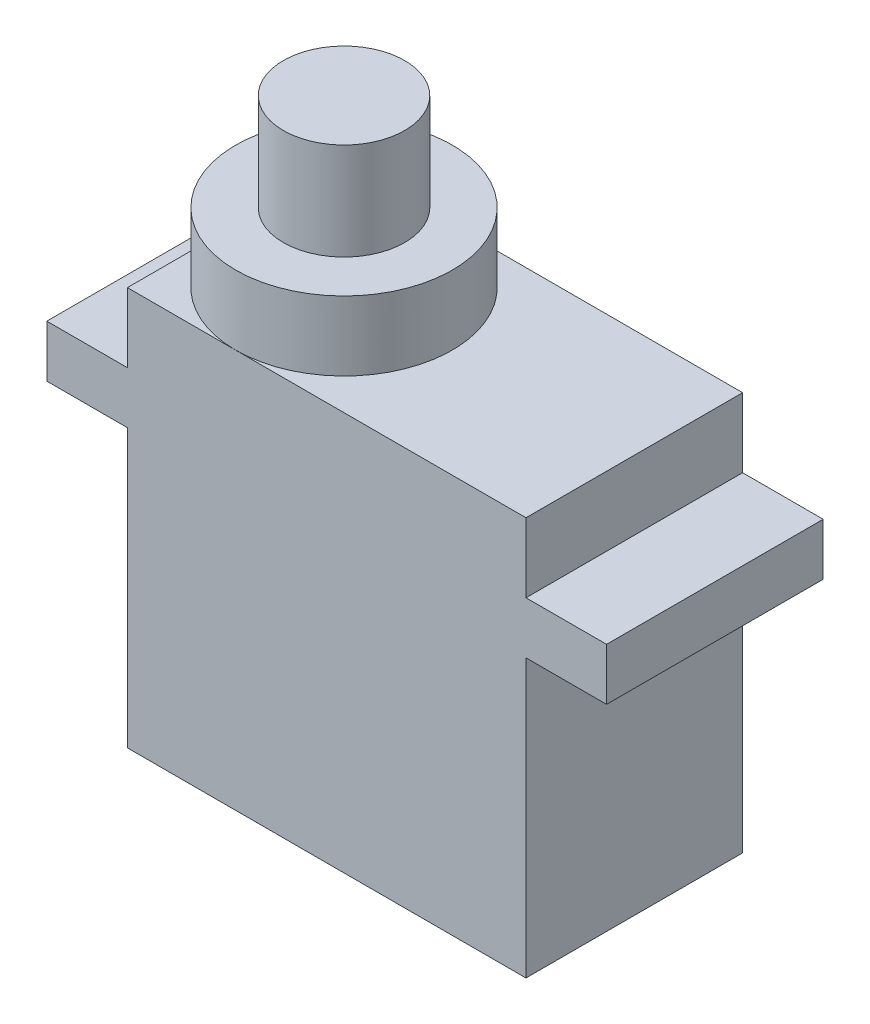
from build123d import *

# Parameters (mm, degrees)
SKETCH1_R           = 3.5
BOSS_EXTRUDE1_DEPTH = 23
BOSS_EXTRUDE2_START = 16
SKETCH1_3_W         = 4.65
SKETCH1_3_H         = 12.5
BOSS_EXTRUDE2_DEPTH = 3
BOSS_EXTRUDE3_START = 23
SKETCH1_4_R         = 6.25
BOSS_EXTRUDE3_DEPTH = 4
BOSS_EXTRUDE4_START = 27
SKETCH1_5_R         = 3.5
BOSS_EXTRUDE4_DEPTH = 5.6


with BuildPart() as part:
    # Sketch1 → Boss-Extrude1 (new body)
    # profile 1 of 8: a face of its own
    with BuildSketch(Plane(origin=(0, 0, 0), x_dir=(1, 0, 0), z_dir=(0, 1, 0))):
        with BuildLine():
            Line((-4.490881441, 6.284153005), (-10.740881441, 6.284153005))
            Line((-10.740881441, 6.284153005), (-10.740881441, 0.034153005))
            ThreePointArc((-10.740881441, 0.034153005), (-8.910298823, 4.453570388), (-4.490881441, 6.284153005))
        make_face()
    # profile 2 of 8: a face of its own
    with BuildSketch(Plane(origin=(0, 0, 0), x_dir=(1, 0, 0), z_dir=(0, 1, 0))):
        with BuildLine():
            ThreePointArc((0.759118559, 3.425317997), (-1.501925201, 5.523109245), (-4.490881441, 6.284153005))
            ThreePointArc((-4.490881441, 6.284153005), (-8.910298823, 4.453570388), (-10.740881441, 0.034153005))
            ThreePointArc((-10.740881441, 0.034153005), (-8.910298823, -4.385264377), (-4.490881441, -6.215846995))
            ThreePointArc((-4.490881441, -6.215846995), (-1.501925201, -5.454803234), (0.759118559, -3.357011986))
            Line((0.759118559, -3.357011986), (0.759118559, 3.425317997))
        make_face()
        with Locations((-4.490881441, 0.034153005)):
            Circle(SKETCH1_R, mode=Mode.SUBTRACT)
    # profile 3 of 8: a face of its own
    with BuildSketch(Plane(origin=(0, 0, 0), x_dir=(1, 0, 0), z_dir=(0, 1, 0))):
        with BuildLine():
            Line((12.259118559, 6.284153005), (0.759118559, 6.284153005))
            Line((0.759118559, 6.284153005), (0.759118559, 3.425317997))
            ThreePointArc((0.759118559, 3.425317997), (1.503907964, 1.801919958), (1.759118559, 0.034153005))
            ThreePointArc((1.759118559, 0.034153005), (1.503907964, -1.733613948), (0.759118559, -3.357011986))
            Line((0.759118559, -3.357011986), (0.759118559, -6.215846995))
            Line((0.759118559, -6.215846995), (12.259118559, -6.215846995))
            Line((12.259118559, -6.215846995), (12.259118559, 6.284153005))
        make_face()
    # profile 4 of 8: a face of its own
    with BuildSketch(Plane(origin=(0, 0, 0), x_dir=(1, 0, 0), z_dir=(0, 1, 0))):
        with BuildLine():
            ThreePointArc((0.759118559, -3.357011986), (-1.501925201, -5.454803234), (-4.490881441, -6.215846995))
            Line((-4.490881441, -6.215846995), (0.759118559, -6.215846995))
            Line((0.759118559, -6.215846995), (0.759118559, -3.357011986))
        make_face()
    # profile 5 of 8: a face of its own
    with BuildSketch(Plane(origin=(0, 0, 0), x_dir=(1, 0, 0), z_dir=(0, 1, 0))):
        with BuildLine():
            Line((0.759118559, 6.284153005), (-4.490881441, 6.284153005))
            ThreePointArc((-4.490881441, 6.284153005), (-1.501925201, 5.523109245), (0.759118559, 3.425317997))
            Line((0.759118559, 3.425317997), (0.759118559, 6.284153005))
        make_face()
    # profile 6 of 8: a face of its own
    with BuildSketch(Plane(origin=(0, 0, 0), x_dir=(1, 0, 0), z_dir=(0, 1, 0))):
        with BuildLine():
            ThreePointArc((1.759118559, 0.034153005), (1.503907964, 1.801919958), (0.759118559, 3.425317997))
            Line((0.759118559, 3.425317997), (0.759118559, -3.357011986))
            ThreePointArc((0.759118559, -3.357011986), (1.503907964, -1.733613948), (1.759118559, 0.034153005))
        make_face()
    # profile 7 of 8: a face of its own
    with BuildSketch(Plane(origin=(0, 0, 0), x_dir=(1, 0, 0), z_dir=(0, 1, 0))):
        with Locations((-4.490881441, 0.034153005)):
            Circle(SKETCH1_R)
    # profile 8 of 8: a face of its own
    with BuildSketch(Plane(origin=(0, 0, 0), x_dir=(1, 0, 0), z_dir=(0, 1, 0))):
        with BuildLine():
            ThreePointArc((-4.490881441, -6.215846995), (-8.910298823, -4.385264377), (-10.740881441, 0.034153005))
            Line((-10.740881441, 0.034153005), (-10.740881441, -6.215846995))
            Line((-10.740881441, -6.215846995), (-4.490881441, -6.215846995))
        make_face()
    extrude(amount=BOSS_EXTRUDE1_DEPTH)

    # Sketch1<3> → Boss-Extrude2 (add)
    with BuildSketch(Plane(origin=(0, 0, 0), x_dir=(1, 0, 0), z_dir=(0, 1, 0)).offset(BOSS_EXTRUDE2_START)):
        with Locations((-13.065881441, 0.034153005)):
            Rectangle(SKETCH1_3_W, SKETCH1_3_H)
        with Locations((14.584118559, 0.034153005)):
            Rectangle(SKETCH1_3_W, SKETCH1_3_H)
    extrude(amount=BOSS_EXTRUDE2_DEPTH)

    # Sketch1<4> → Boss-Extrude3 (add)
    with BuildSketch(Plane(origin=(0, 0, 0), x_dir=(1, 0, 0), z_dir=(0, 1, 0)).offset(BOSS_EXTRUDE3_START)):
        with Locations(Location((-4.490881441, 0.034153005, 0), (0, 0, 270))):
            Circle(SKETCH1_4_R)
    extrude(amount=BOSS_EXTRUDE3_DEPTH)

    # Sketch1<5> → Boss-Extrude4 (add)
    with BuildSketch(Plane(origin=(0, 0, 0), x_dir=(1, 0, 0), z_dir=(0, 1, 0)).offset(BOSS_EXTRUDE4_START)):
        with Locations(Location((-4.490881441, 0.034153005, 0), (0, 0, 270))):
            Circle(SKETCH1_5_R)
    extrude(amount=BOSS_EXTRUDE4_DEPTH)


solid = part.part
